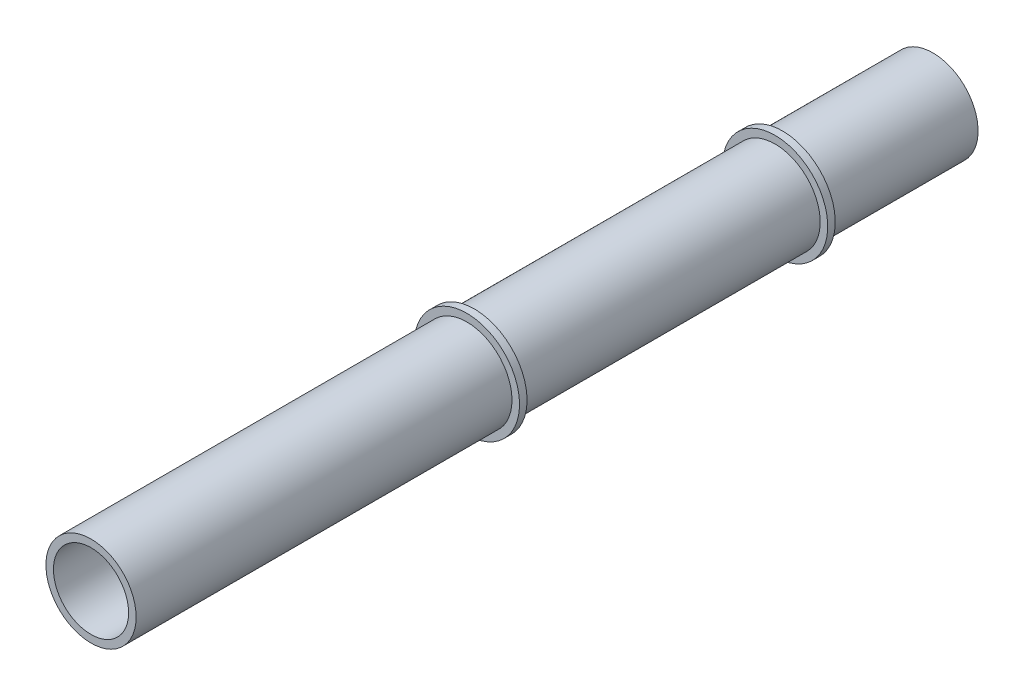
from build123d import *

# Parameters (mm, degrees)
SKETCH1_R           = 6
BOSS_EXTRUDE1_DEPTH = 50
SKETCH2_R           = 7
BOSS_EXTRUDE2_DEPTH = 1
SKETCH3_R           = 6
BOSS_EXTRUDE3_DEPTH = 40
SKETCH4_R           = 7
BOSS_EXTRUDE4_DEPTH = 1
BOSS_EXTRUDE5_START = 20
SKETCH5_R           = 6
BOSS_EXTRUDE5_DEPTH = 20
SKETCH6_R           = 5
CUT_EXTRUDE1_DEPTH  = 200


with BuildPart() as part:
    # Sketch1 → Boss-Extrude1 (new body)
    with BuildSketch(Plane.XY):
        Circle(SKETCH1_R)
    extrude(amount=BOSS_EXTRUDE1_DEPTH)


with BuildPart() as body_2:
    # Sketch2 → Boss-Extrude2 (new body)
    with BuildSketch(Plane(origin=(0, 0, 0), x_dir=(-1, 0, 0), z_dir=(0, 0, -1))):
        Circle(SKETCH2_R)
    extrude(amount=BOSS_EXTRUDE2_DEPTH)


with BuildPart() as body_3:
    # Sketch3 → Boss-Extrude3 (new body)
    with BuildSketch(Plane(origin=(0, 0, -1), x_dir=(-1, 0, 0), z_dir=(0, 0, -1))):
        Circle(SKETCH3_R)
    extrude(amount=BOSS_EXTRUDE3_DEPTH)

    # Sketch4 → Boss-Extrude4 (add)
    with BuildSketch(Plane(origin=(0, 0, -41), x_dir=(-1, 0, 0), z_dir=(0, 0, -1))):
        Circle(SKETCH4_R)
    extrude(amount=BOSS_EXTRUDE4_DEPTH)

    # Sketch5 → Boss-Extrude5 (add)
    with BuildSketch(Plane(origin=(0, 0, -42), x_dir=(-1, 0, 0), z_dir=(0, 0, -1)).offset(BOSS_EXTRUDE5_START)):
        Circle(SKETCH5_R)
    extrude(amount=-BOSS_EXTRUDE5_DEPTH)


with BuildPart() as cut_extrude1_tool:
    # Sketch6 → Cut-Extrude1 (new body)
    with BuildSketch(Plane(origin=(0, 0, -62), x_dir=(-1, 0, 0), z_dir=(0, 0, -1))):
        Circle(SKETCH6_R)
    extrude(amount=-CUT_EXTRUDE1_DEPTH)


with BuildPart() as part_1:
    add(part.part)

    # Cut-Extrude1: cut by cut_extrude1_tool
    add(cut_extrude1_tool.part, mode=Mode.SUBTRACT)


with BuildPart() as body_2_1:
    add(body_2.part)

    # Cut-Extrude1: cut by cut_extrude1_tool
    add(cut_extrude1_tool.part, mode=Mode.SUBTRACT)


with BuildPart() as body_3_1:
    add(body_3.part)

    # Cut-Extrude1: cut by cut_extrude1_tool
    add(cut_extrude1_tool.part, mode=Mode.SUBTRACT)


solid = Compound([part_1.part, body_2_1.part, body_3_1.part])
